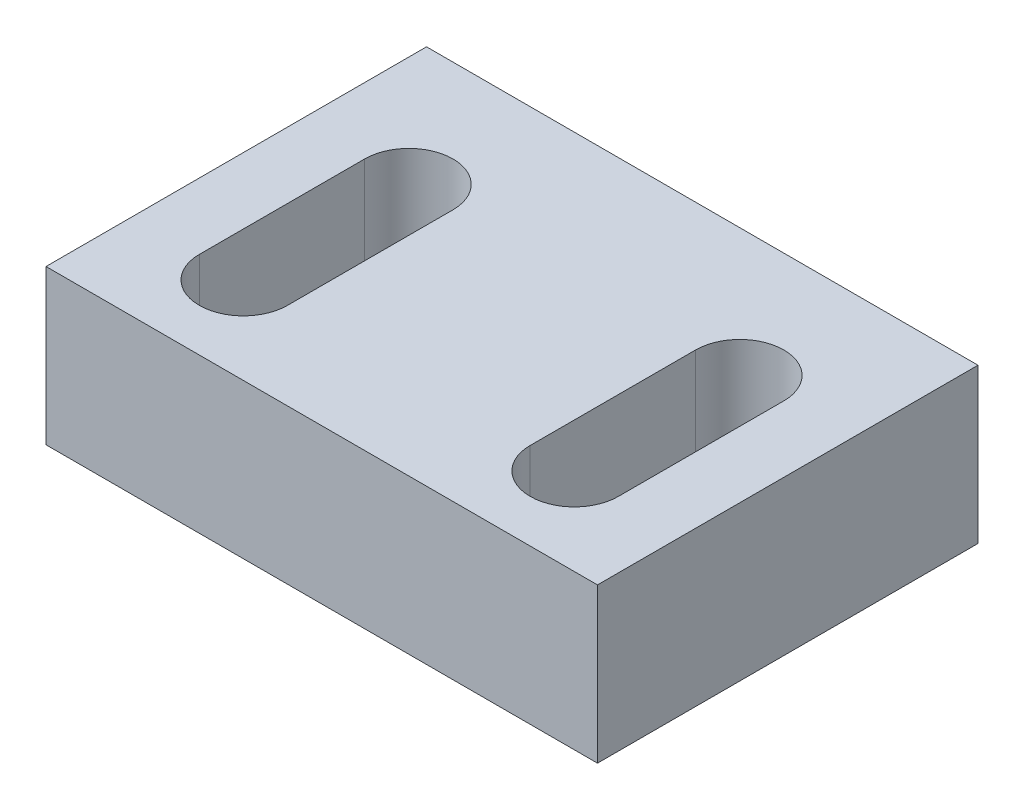
from build123d import *

# Parameters (mm, degrees)
SKETCH1_W           = 50
SKETCH1_H           = 34.5
BOSS_EXTRUDE1_DEPTH = 7


with BuildPart() as part:
    # Sketch1 → Boss-Extrude1 (new, symmetric)
    with BuildSketch(Plane(origin=(0, 0, 0), x_dir=(1, 0, 0), z_dir=(0, 1, 0))):
        Rectangle(SKETCH1_W, SKETCH1_H)
        with BuildLine():
            Line((-11, 5.646273024), (-11, -9.353726976))
            ThreePointArc((-11, -9.353726976), (-15, -13.353726976), (-19, -9.353726976))
            Line((-19, -9.353726976), (-19, 5.646273024))
            ThreePointArc((-19, 5.646273024), (-15, 9.646273024), (-11, 5.646273024))
        make_face(mode=Mode.SUBTRACT)
        with BuildLine():
            Line((11, 5.646273024), (11, -9.353726976))
            ThreePointArc((11, -9.353726976), (15, -13.353726976), (19, -9.353726976))
            Line((19, -9.353726976), (19, 5.646273024))
            ThreePointArc((19, 5.646273024), (15, 9.646273024), (11, 5.646273024))
        make_face(mode=Mode.SUBTRACT)
    extrude(amount=BOSS_EXTRUDE1_DEPTH, both=True)


solid = part.part
